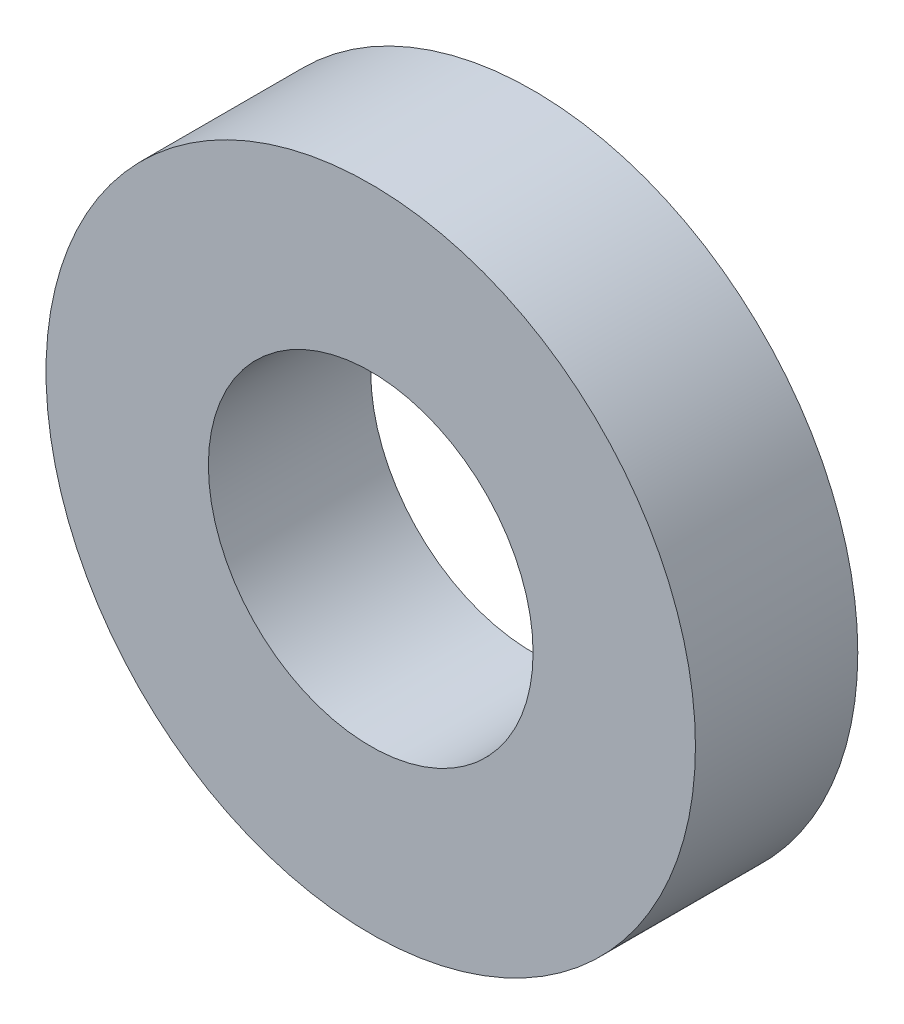
from build123d import *

# Parameters (mm, degrees)
SKETCH2_R           = 2
SKETCH2_R_2         = 1
BOSS_EXTRUDE1_DEPTH = 1


with BuildPart() as part:
    # Sketch2 → Boss-Extrude1 (new body)
    with BuildSketch(Plane.XY):
        Circle(SKETCH2_R)
        Circle(SKETCH2_R_2, mode=Mode.SUBTRACT)
    extrude(amount=BOSS_EXTRUDE1_DEPTH)


solid = part.part
